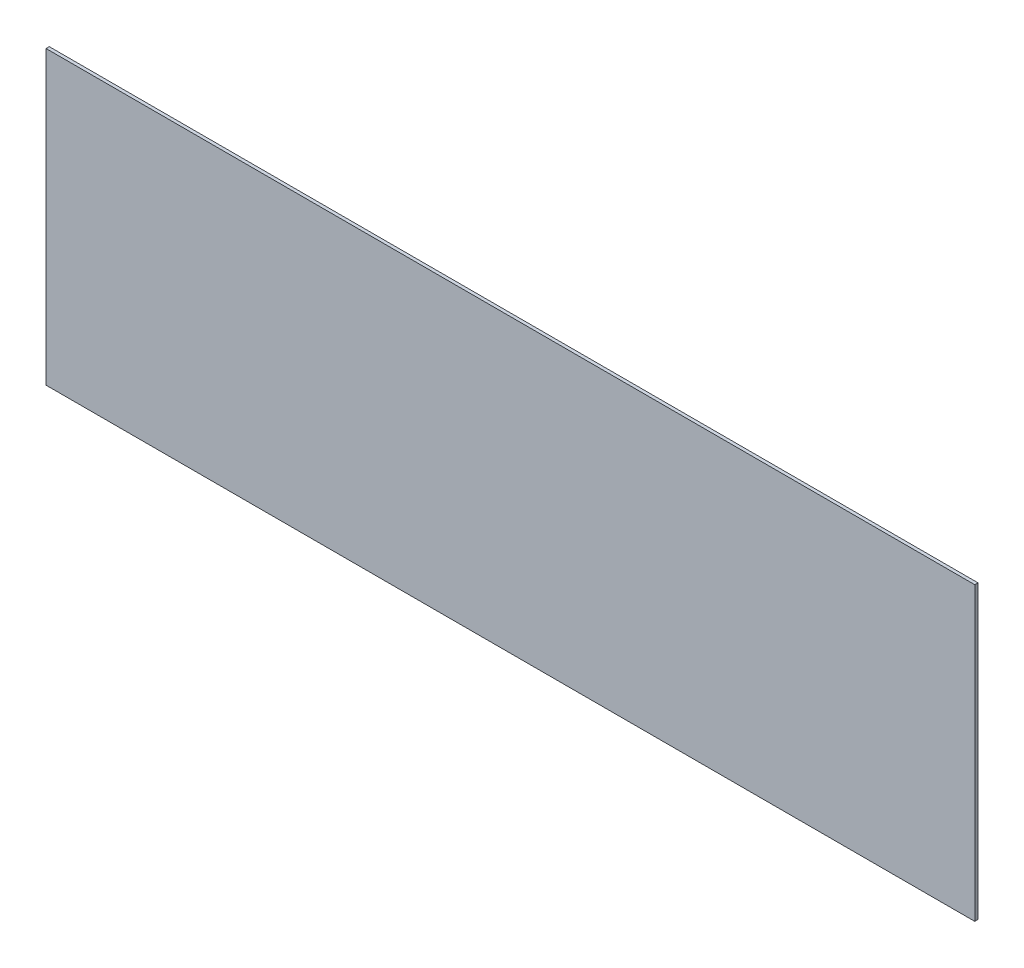
from build123d import *

# Parameters (mm, degrees)
SKETCH1_W           = 860
SKETCH1_H           = 270
BOSS_EXTRUDE1_DEPTH = 3


with BuildPart() as part:
    # Sketch1 → Boss-Extrude1 (new body)
    with BuildSketch(Plane.XY):
        Rectangle(SKETCH1_W, SKETCH1_H)
    extrude(amount=BOSS_EXTRUDE1_DEPTH)


solid = part.part
